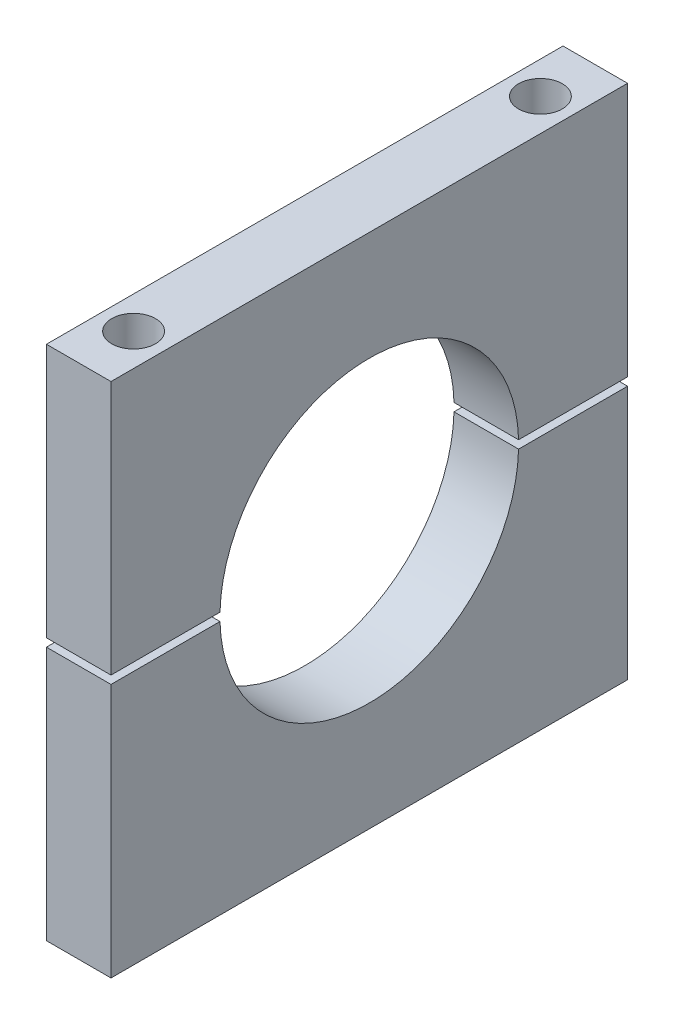
from build123d import *

# Parameters (mm, degrees)
BOSS_EXTRUDE1_DEPTH                   = 3.175
BOSS_EXTRUDE1_2_DEPTH                 = 3.175
SKETCH4_W                             = 2.15265
SKETCH4_H                             = 25.003125
F_18_0_1695_DIAMETER_HOLE2_AT_2_COUNT = 2
F_18_0_1695_DIAMETER_HOLE2_AT_2_PITCH = 40.005
SKETCH5_W                             = 1.7272
SKETCH5_H                             = 50.8
F_29_0_136_DIAMETER_HOLE1_AT_2_COUNT  = 2
F_29_0_136_DIAMETER_HOLE1_AT_2_PITCH  = 40.005


with BuildPart() as part:
    # Sketch1 → Boss-Extrude1 (new, symmetric)
    with BuildSketch(Plane(origin=(0, 0, 0), x_dir=(0, 0, -1), z_dir=(1, 0, 0))):
        with BuildLine():
            Line((-25.4, 25.4), (-25.4, 0.396875))
            Line((-25.4, 0.396875), (-14.682136986, 0.396875))
            ThreePointArc((-14.682136986, 0.396875), (0, 14.6875), (14.682136986, 0.396875))
            Line((14.682136986, 0.396875), (25.4, 0.396875))
            Line((25.4, 0.396875), (25.4, 25.4))
            Line((25.4, 25.4), (-25.4, 25.4))
        make_face()
    extrude(amount=BOSS_EXTRUDE1_DEPTH, both=True)

    # Sketch4 → #18 (0.1695) Diameter Hole2 (revolve, cut)
    with BuildSketch(Plane(origin=(0, 25.4, 20.0025), x_dir=(0, 0, 1), z_dir=(1, 0, 0))):
        with Locations((1.076325, 12.5015625)):
            Rectangle(SKETCH4_W, SKETCH4_H)
    f_18_0_1695_diameter_hole2 = revolve(axis=Axis((0, 31.75, 20.0025), (0, -1, 0)), mode=Mode.SUBTRACT)

    # #18 (0.1695) Diameter Hole2 at 2: #18 (0.1695) Diameter Hole2 ×2
    with Locations(*[(0, 0, -i * F_18_0_1695_DIAMETER_HOLE2_AT_2_PITCH) for i in range(1, F_18_0_1695_DIAMETER_HOLE2_AT_2_COUNT)]):
        add(f_18_0_1695_diameter_hole2, mode=Mode.SUBTRACT)


with BuildPart() as body_2:
    # Sketch1 → Boss-Extrude1 2 (new, symmetric)
    with BuildSketch(Plane(origin=(0, 0, 0), x_dir=(0, 0, -1), z_dir=(1, 0, 0))):
        with BuildLine():
            Line((-14.682136986, -0.396875), (-25.4, -0.396875))
            Line((-25.4, -0.396875), (-25.4, -25.4))
            Line((-25.4, -25.4), (25.4, -25.4))
            Line((25.4, -25.4), (25.4, -0.396875))
            Line((25.4, -0.396875), (14.682136986, -0.396875))
            ThreePointArc((14.682136986, -0.396875), (0, -14.6875), (-14.682136986, -0.396875))
        make_face()
    extrude(amount=BOSS_EXTRUDE1_2_DEPTH, both=True)

    # Sketch5 → #29 (0.136) Diameter Hole1 (revolve, cut)
    with BuildSketch(Plane(origin=(0, 25.4, 20.0025), x_dir=(0, 0, 1), z_dir=(1, 0, 0))):
        with Locations((0.8636, 25.4)):
            Rectangle(SKETCH5_W, SKETCH5_H)
    f_29_0_136_diameter_hole1 = revolve(axis=Axis((0, 31.75, 20.0025), (0, -1, 0)), mode=Mode.SUBTRACT)

    # #29 (0.136) Diameter Hole1 at 2: #29 (0.136) Diameter Hole1 ×2
    with Locations(*[(0, 0, -i * F_29_0_136_DIAMETER_HOLE1_AT_2_PITCH) for i in range(1, F_29_0_136_DIAMETER_HOLE1_AT_2_COUNT)]):
        add(f_29_0_136_diameter_hole1, mode=Mode.SUBTRACT)


solid = Compound([part.part, body_2.part])
